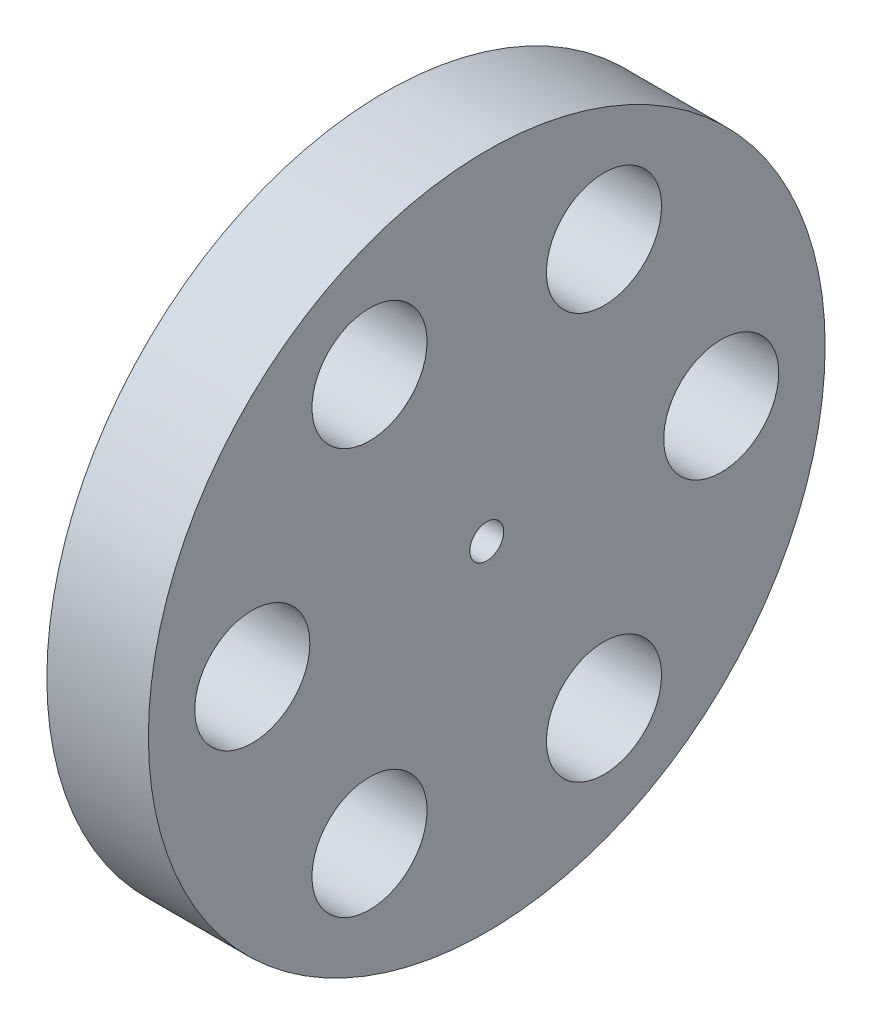
from build123d import *

# Parameters (mm, degrees)
SKETCH_1_R      = 50
SKETCH_1_R_2    = 8.5
SKETCH_1_R_3    = 2.5
EXTRUDE_1_DEPTH = 15


with BuildPart() as part:
    # 草圖1 → 填料-伸長1 (new body)
    with BuildSketch(Plane(origin=(0, 0, 0), x_dir=(0, 0, -1), z_dir=(1, 0, 0))):
        Circle(SKETCH_1_R)
        with Locations((17.320508076, 30)):
            Circle(SKETCH_1_R_2, mode=Mode.SUBTRACT)
        with Locations((34.641016151, 0)):
            Circle(SKETCH_1_R_2, mode=Mode.SUBTRACT)
        with Locations((17.320508076, -30)):
            Circle(SKETCH_1_R_2, mode=Mode.SUBTRACT)
        with Locations((-17.320508076, -30)):
            Circle(SKETCH_1_R_2, mode=Mode.SUBTRACT)
        with Locations((-34.641016151, 0)):
            Circle(SKETCH_1_R_2, mode=Mode.SUBTRACT)
        with Locations((-17.320508076, 30)):
            Circle(SKETCH_1_R_2, mode=Mode.SUBTRACT)
        Circle(SKETCH_1_R_3, mode=Mode.SUBTRACT)
    extrude(amount=EXTRUDE_1_DEPTH)


solid = part.part
